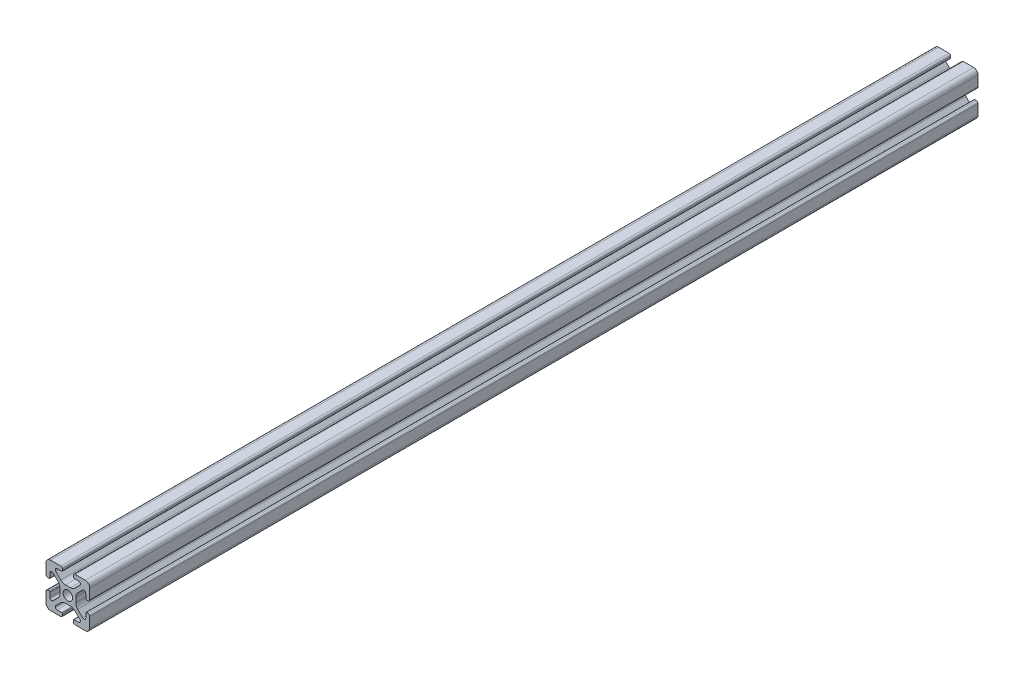
from build123d import *

# Parameters (mm, degrees)
SKETCH1_R           = 2.1463
BOSS_EXTRUDE1_DEPTH = 203.2


with BuildPart() as part:
    # Sketch1 → Boss-Extrude1 (new, symmetric)
    with BuildSketch(Plane.XY):
        with BuildLine():
            Line((-9.9949, 7.9883), (-9.9949, 3.2893))
            ThreePointArc((-9.9949, 3.2893), (-9.76427588, 2.73252412), (-9.2075, 2.5019))
            Line((-9.2075, 2.5019), (-8.4963, 2.5019))
            ThreePointArc((-8.4963, 2.5019), (-8.280773853, 2.591173853), (-8.1915, 2.8067))
            Line((-8.1915, 2.8067), (-8.1915, 4.9149))
            ThreePointArc((-8.1915, 4.9149), (-7.674065253, 5.689295824), (-6.760603096, 5.507596904))
            Line((-6.760603096, 5.507596904), (-4.505765747, 3.252759555))
            ThreePointArc((-4.505765747, 3.252759555), (-3.856054457, 2.280397894), (-3.627906192, 1.133419111))
            Line((-3.627906192, 1.133419111), (-3.627906192, -1.133419111))
            ThreePointArc((-3.627906192, -1.133419111), (-3.856054457, -2.280397894), (-4.505765747, -3.252759555))
            Line((-4.505765747, -3.252759555), (-6.760603096, -5.507596904))
            ThreePointArc((-6.760603096, -5.507596904), (-7.674065253, -5.689295824), (-8.1915, -4.9149))
            Line((-8.1915, -4.9149), (-8.1915, -2.8067))
            ThreePointArc((-8.1915, -2.8067), (-8.280773853, -2.591173853), (-8.4963, -2.5019))
            Line((-8.4963, -2.5019), (-9.2075, -2.5019))
            ThreePointArc((-9.2075, -2.5019), (-9.76427588, -2.73252412), (-9.9949, -3.2893))
            Line((-9.9949, -3.2893), (-9.9949, -7.9883))
            ThreePointArc((-9.9949, -7.9883), (-9.407180467, -9.407180467), (-7.9883, -9.9949))
            Line((-7.9883, -9.9949), (-3.2893, -9.9949))
            ThreePointArc((-3.2893, -9.9949), (-2.73252412, -9.76427588), (-2.5019, -9.2075))
            Line((-2.5019, -9.2075), (-2.5019, -8.4963))
            ThreePointArc((-2.5019, -8.4963), (-2.591173853, -8.280773853), (-2.8067, -8.1915))
            Line((-2.8067, -8.1915), (-4.9149, -8.1915))
            ThreePointArc((-4.9149, -8.1915), (-5.689295824, -7.674065253), (-5.507596904, -6.760603096))
            Line((-5.507596904, -6.760603096), (-3.252759555, -4.505765747))
            ThreePointArc((-3.252759555, -4.505765747), (-2.280397894, -3.856054457), (-1.133419111, -3.627906192))
            Line((-1.133419111, -3.627906192), (1.133419111, -3.627906192))
            ThreePointArc((1.133419111, -3.627906192), (2.280397894, -3.856054457), (3.252759555, -4.505765747))
            Line((3.252759555, -4.505765747), (5.507596904, -6.760603096))
            ThreePointArc((5.507596904, -6.760603096), (5.689295824, -7.674065253), (4.9149, -8.1915))
            Line((4.9149, -8.1915), (2.8067, -8.1915))
            ThreePointArc((2.8067, -8.1915), (2.591173853, -8.280773853), (2.5019, -8.4963))
            Line((2.5019, -8.4963), (2.5019, -9.2075))
            ThreePointArc((2.5019, -9.2075), (2.73252412, -9.76427588), (3.2893, -9.9949))
            Line((3.2893, -9.9949), (7.9883, -9.9949))
            ThreePointArc((7.9883, -9.9949), (9.407180467, -9.407180467), (9.9949, -7.9883))
            Line((9.9949, -7.9883), (9.9949, -3.2893))
            ThreePointArc((9.9949, -3.2893), (9.76427588, -2.73252412), (9.2075, -2.5019))
            Line((9.2075, -2.5019), (8.4963, -2.5019))
            ThreePointArc((8.4963, -2.5019), (8.280773853, -2.591173853), (8.1915, -2.8067))
            Line((8.1915, -2.8067), (8.1915, -4.9149))
            ThreePointArc((8.1915, -4.9149), (7.674065253, -5.689295824), (6.760603096, -5.507596904))
            Line((6.760603096, -5.507596904), (4.505765747, -3.252759555))
            ThreePointArc((4.505765747, -3.252759555), (3.856054457, -2.280397894), (3.627906192, -1.133419111))
            Line((3.627906192, -1.133419111), (3.627906192, 1.133419111))
            ThreePointArc((3.627906192, 1.133419111), (3.856054457, 2.280397894), (4.505765747, 3.252759555))
            Line((4.505765747, 3.252759555), (6.760603096, 5.507596904))
            ThreePointArc((6.760603096, 5.507596904), (7.674065253, 5.689295824), (8.1915, 4.9149))
            Line((8.1915, 4.9149), (8.1915, 2.8067))
            ThreePointArc((8.1915, 2.8067), (8.280773853, 2.591173853), (8.4963, 2.5019))
            Line((8.4963, 2.5019), (9.2075, 2.5019))
            ThreePointArc((9.2075, 2.5019), (9.76427588, 2.73252412), (9.9949, 3.2893))
            Line((9.9949, 3.2893), (9.9949, 7.9883))
            ThreePointArc((9.9949, 7.9883), (9.407180467, 9.407180467), (7.9883, 9.9949))
            Line((7.9883, 9.9949), (3.2893, 9.9949))
            ThreePointArc((3.2893, 9.9949), (2.73252412, 9.76427588), (2.5019, 9.2075))
            Line((2.5019, 9.2075), (2.5019, 8.4963))
            ThreePointArc((2.5019, 8.4963), (2.591173853, 8.280773853), (2.8067, 8.1915))
            Line((2.8067, 8.1915), (4.9149, 8.1915))
            ThreePointArc((4.9149, 8.1915), (5.689295824, 7.674065253), (5.507596904, 6.760603096))
            Line((5.507596904, 6.760603096), (3.252759555, 4.505765747))
            ThreePointArc((3.252759555, 4.505765747), (2.280397894, 3.856054457), (1.133419111, 3.627906192))
            Line((1.133419111, 3.627906192), (-1.133419111, 3.627906192))
            ThreePointArc((-1.133419111, 3.627906192), (-2.280397894, 3.856054457), (-3.252759555, 4.505765747))
            Line((-3.252759555, 4.505765747), (-5.507596904, 6.760603096))
            ThreePointArc((-5.507596904, 6.760603096), (-5.689295824, 7.674065253), (-4.9149, 8.1915))
            Line((-4.9149, 8.1915), (-2.8067, 8.1915))
            ThreePointArc((-2.8067, 8.1915), (-2.591173853, 8.280773853), (-2.5019, 8.4963))
            Line((-2.5019, 8.4963), (-2.5019, 9.2075))
            ThreePointArc((-2.5019, 9.2075), (-2.73252412, 9.76427588), (-3.2893, 9.9949))
            Line((-3.2893, 9.9949), (-7.9883, 9.9949))
            ThreePointArc((-7.9883, 9.9949), (-9.407180467, 9.407180467), (-9.9949, 7.9883))
        make_face()
        Circle(SKETCH1_R, mode=Mode.SUBTRACT)
    extrude(amount=BOSS_EXTRUDE1_DEPTH, both=True)


solid = part.part
